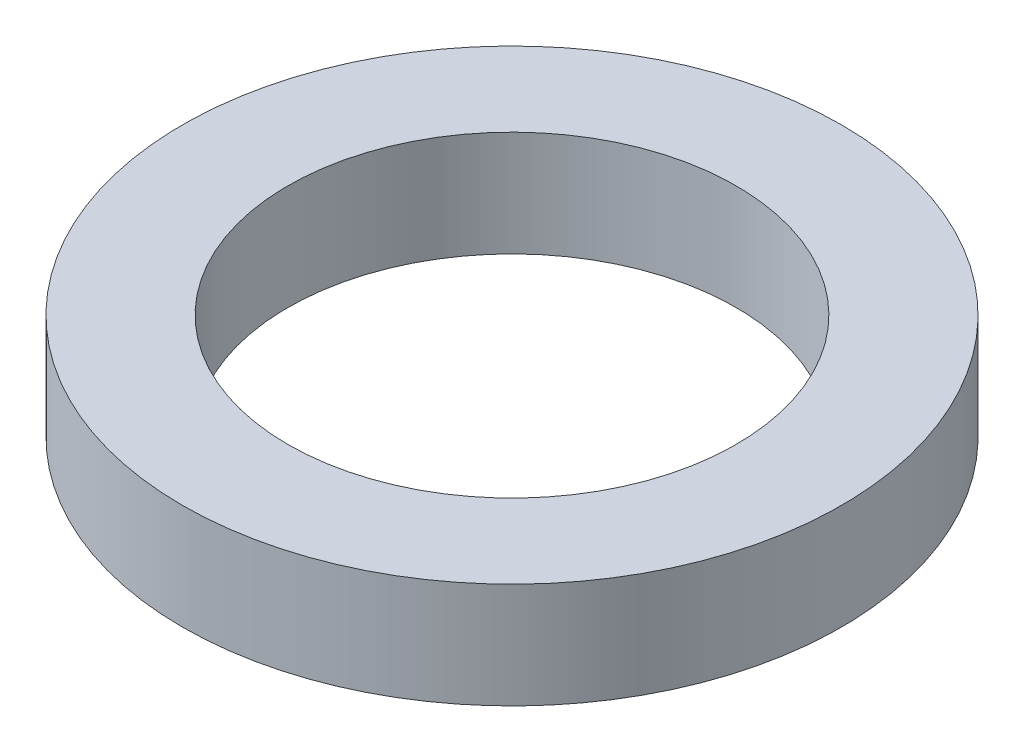
from build123d import *

# Parameters (mm, degrees)
SKETCH_1_R      = 2.5
SKETCH_1_R_2    = 1.7
EXTRUDE_1_DEPTH = 0.8


with BuildPart() as part:
    # 草图1 → 凸台-拉伸1 (new body)
    with BuildSketch(Plane(origin=(0, 0, 0), x_dir=(1, 0, 0), z_dir=(0, 1, 0))):
        with Locations(Location((0, 0, 0), (0, 0, 270))):
            Circle(SKETCH_1_R)
        with Locations(Location((0, 0, 0), (0, 0, 270))):
            Circle(SKETCH_1_R_2, mode=Mode.SUBTRACT)
    extrude(amount=EXTRUDE_1_DEPTH)


solid = part.part
